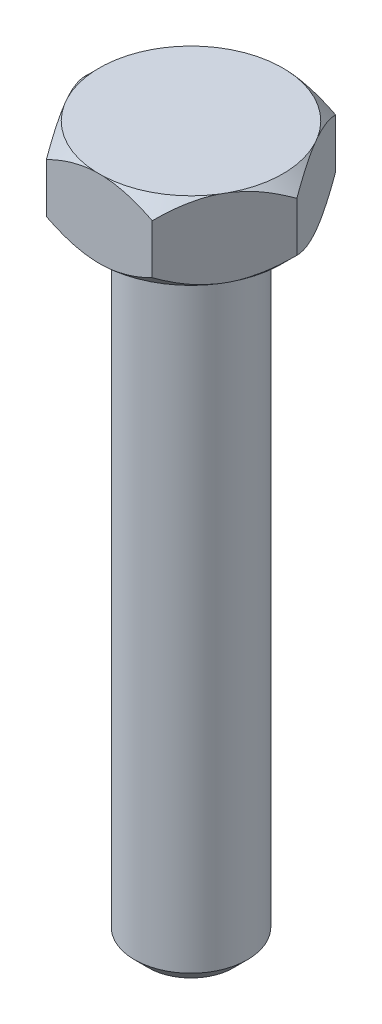
from build123d import *

# Parameters (mm, degrees)
EXTRUDE_1_DEPTH = 5.5
SKETCH_5_R      = 4
EXTRUDE_2_DEPTH = 45
CHAMFER_1_SIZE  = 1


with BuildPart() as part:
    # Эскиз1 → Вытянуть1 (new body)
    with BuildSketch(Plane(origin=(0, 0, 0), x_dir=(1, 0, 0), z_dir=(0, 1, 0))):
        Polygon((-3.75277675, 6.5), (3.75277675, 6.5), (7.505553499, 0), (3.75277675, -6.5), (-3.75277675, -6.5), (-7.505553499, 0), align=None)
    extrude(amount=-EXTRUDE_1_DEPTH)

    # Эскиз5 → Вытянуть2 (add)
    with BuildSketch(Plane.XZ.offset(5.5)):
        with Locations(Location((0, 0, 0), (0, 0, 90))):
            Circle(SKETCH_5_R)
    extrude(amount=EXTRUDE_2_DEPTH)

    # Фаска1
    chamfer_1_edges = [part.edges().sort_by_distance(p)[0] for p in [
        (0, -50.5, -4),
    ]]
    chamfer(chamfer_1_edges, length=CHAMFER_1_SIZE)

    # Эскиз4 → Вырез-Повернуть1 (revolve, cut)
    with BuildSketch(Plane.XY):
        Polygon((-7.505553499, -1), (-6.505553499, 0), (-7.505553499, 0), align=None)
        Polygon((-7.505553499, -4.5), (-6.505553499, -5.5), (-7.505553499, -5.5), align=None)
    revolve(axis=Axis((0, -5.5, 0), (0, -1, 0)), mode=Mode.SUBTRACT)


solid = part.part
